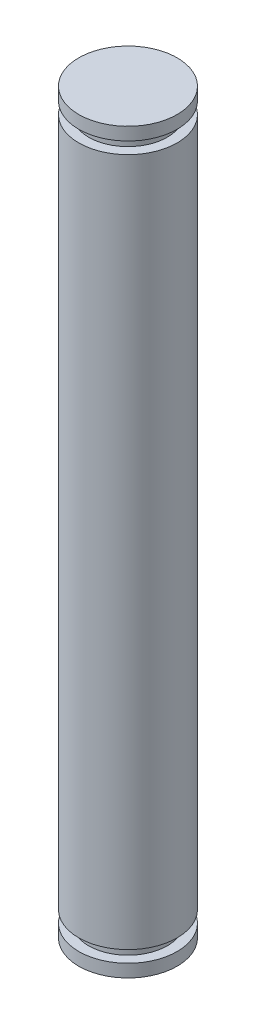
from build123d import *


with BuildPart() as part:
    # 草图1 → 旋转1 (revolve)
    with BuildSketch(Plane.XY, mode=Mode.PRIVATE) as revolve_1_sk:
        Polygon((0, 0), (-5, 0), (-5, 1.3), (-4, 1.3), (-4, 2.5), (-5, 2.5), (-5, 72.5), (-4, 72.5), (-4, 73.7), (-5, 73.7), (-5, 75), (0, 75), align=None)
    revolve(revolve_1_sk.sketch.rotate(Axis((0, 75, 0), (0, -1, 0)), 270), axis=Axis((0, 75, 0), (0, -1, 0)))


solid = part.part
